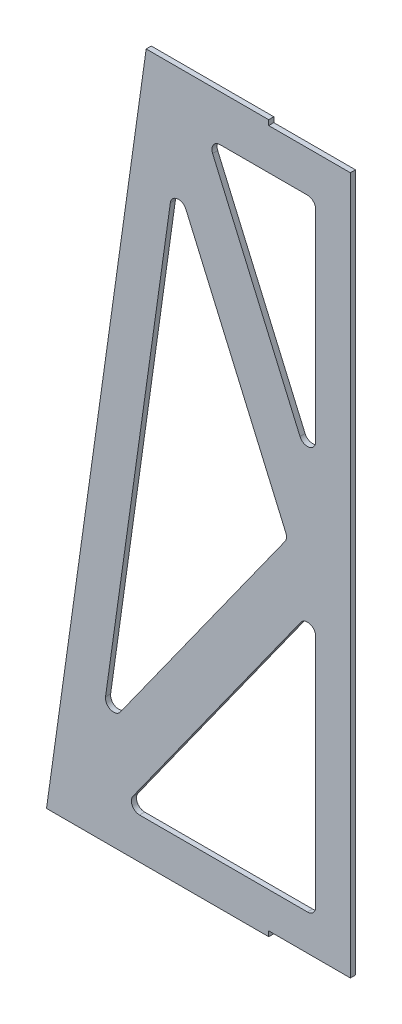
from build123d import *

# Parameters (mm, degrees)
BOSS_EXTRUDE2_DEPTH = 1.5875
CUT_EXTRUDE4_DEPTH  = 216.037664516
FILLET4_R           = 2.54
SKETCH8_W           = 25.4
SKETCH8_H           = 1.5875
CUT_EXTRUDE5_DEPTH  = 216.037664516


with BuildPart() as part:
    # Sketch6 → Boss-Extrude2 (new body)
    with BuildSketch(Plane.XY):
        Polygon((63.5, 12.997971671), (63.5, -205.442028329), (-30.988, -205.442028329), (0, 14.585471671), (38.1, 14.585471671), (38.1, 12.997971671), align=None)
    extrude(amount=BOSS_EXTRUDE2_DEPTH)

    # Sketch7 → Cut-Extrude4 (cut, through all)
    with BuildSketch(Plane.XY.offset(1.5875)):
        Polygon((-14.078119511, -176.440074821), (43.990131885, -95.296788202), (8.777825003, -14.153501583), align=None)
        Polygon((-7.003851095, -192.742028329), (52.698191605, -109.315717977), (52.698191605, -192.742028329), align=None)
        Polygon((52.698191605, -77.080404102), (19.119676028, 0.297971671), (52.698191605, 0.297971671), align=None)
    extrude(amount=-CUT_EXTRUDE4_DEPTH, mode=Mode.SUBTRACT)

    # Fillet4
    fillet4_edges = [part.edges().sort_by_distance(p)[0] for p in [
        (52.698191605, -109.315717977, 0.79375),
        (52.698191605, -192.742028329, 0.79375),
        (-7.003851095, -192.742028329, 0.79375),
        (-14.078119511, -176.440074821, 0.79375),
        (8.777825003, -14.153501583, 0.79375),
        (43.990131885, -95.296788202, 0.79375),
        (52.698191605, 0.297971671, 0.79375),
        (52.698191605, -77.080404102, 0.79375),
        (19.119676028, 0.297971671, 0.79375),
    ]]
    fillet(fillet4_edges, radius=FILLET4_R)

    # Sketch8 → Cut-Extrude5 (cut, through all)
    with BuildSketch(Plane.XY.offset(1.5875)):
        with Locations((50.8, -204.648278329)):
            Rectangle(SKETCH8_W, SKETCH8_H)
    extrude(amount=-CUT_EXTRUDE5_DEPTH, mode=Mode.SUBTRACT)


solid = part.part
